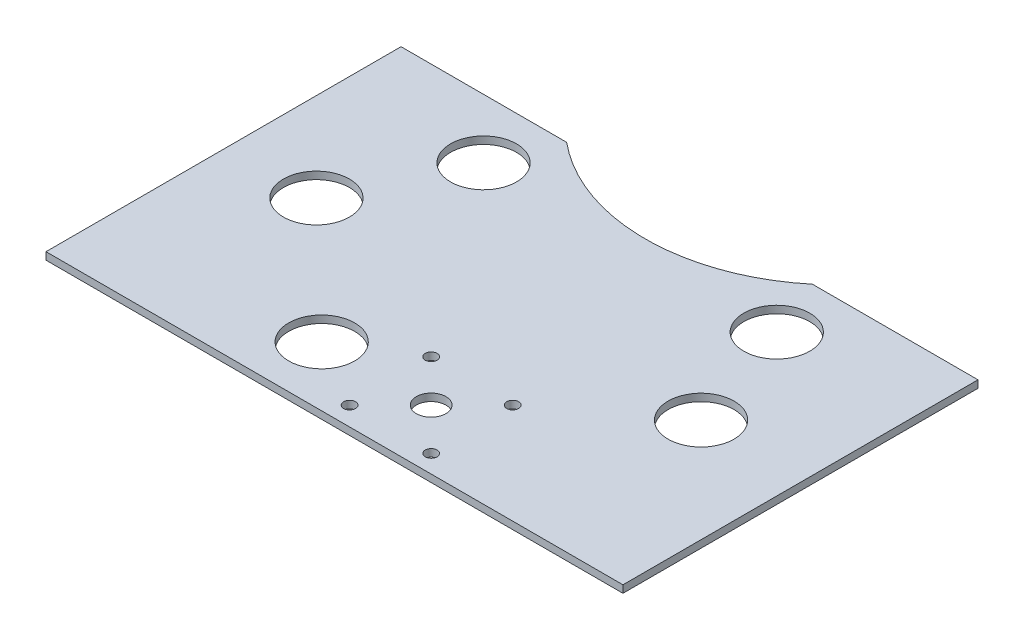
from build123d import *

# Parameters (mm, degrees)
BOSS_EXTRUDE1_DEPTH     = 3.175
F_1_0_5_DOWEL_HOLE1_D   = 12.7
F_10_CLEARANCE_HOLE1_D  = 5.1054
F_1_1_115_DOWEL_HOLE3_D = 28.321
SKETCH11_R              = 14.1605
CUT_EXTRUDE1_DEPTH      = 158.031276025
SKETCH12_R              = 14.1605
CUT_EXTRUDE2_DEPTH      = 158.031276025


with BuildPart() as part:
    # Sketch1 → Boss-Extrude1 (new body)
    with BuildSketch(Plane(origin=(0, 0, 0), x_dir=(1, 0, 0), z_dir=(0, 1, 0))):
        with BuildLine():
            Line((-123.825, -55.88), (123.825, -55.88))
            Line((123.825, -55.88), (123.825, 96.52))
            Line((123.825, 96.52), (52.74706153, 96.52))
            ThreePointArc((52.74706153, 96.52), (0, 77.47), (-52.74706153, 96.52))
            Line((-52.74706153, 96.52), (-123.825, 96.52))
            Line((-123.825, 96.52), (-123.825, -55.88))
        make_face()
    extrude(amount=BOSS_EXTRUDE1_DEPTH)

    # 1 (0.5) Dowel Hole1 (through all)
    with Locations(Plane(origin=(0, 3.175, 0), x_dir=(1, 0, 0), z_dir=(0, 1, 0))):
        with Locations((15.875, -30.256942448)):
            Hole(F_1_0_5_DOWEL_HOLE1_D / 2)

    # #10 Clearance Hole1 (through all)
    with Locations(Plane(origin=(0, 3.175, 0), x_dir=(1, 0, 0), z_dir=(0, 1, 0))):
        with Locations((-1.625, -47.756942448), (33.375, -12.756942448), (-2.085512242, -12.296430205), (33.835512242, -48.21745469)):
            Hole(F_10_CLEARANCE_HOLE1_D / 2)

    # 1 (1.115) Dowel Hole3 (through all)
    with Locations(Plane(origin=(-3.175, -34.925, 0), x_dir=(-1, 0, 0), z_dir=(0, -1, 0))):
        with Locations((82.55, 22.098), (-82.55, 22.098)):
            Hole(F_1_1_115_DOWEL_HOLE3_D / 2)

    # Sketch11 → Cut-Extrude1 (cut, through all)
    with BuildSketch(Plane(origin=(0, 3.175, 0), x_dir=(1, 0, 0), z_dir=(0, 1, 0))):
        with Locations(Location((-31.115, -30.256942448, 0), (0, 0, 270))):
            Circle(SKETCH11_R)
    extrude(amount=-CUT_EXTRUDE1_DEPTH, mode=Mode.SUBTRACT)

    # Sketch12 → Cut-Extrude2 (cut, through all)
    with BuildSketch(Plane(origin=(0, 3.175, 0), x_dir=(1, 0, 0), z_dir=(0, 1, 0))):
        with Locations(Location((-62.933495539, 71.035024331, 0), (0, 0, 270))):
            Circle(SKETCH12_R)
    cut_extrude2 = extrude(amount=-CUT_EXTRUDE2_DEPTH, mode=Mode.SUBTRACT)

    # Mirror2: Cut-Extrude2 across plane
    add(cut_extrude2.mirror(Plane(origin=(0, 0, 0), x_dir=(0, 0, 1), z_dir=(1, 0, 0))), mode=Mode.SUBTRACT)


solid = part.part
